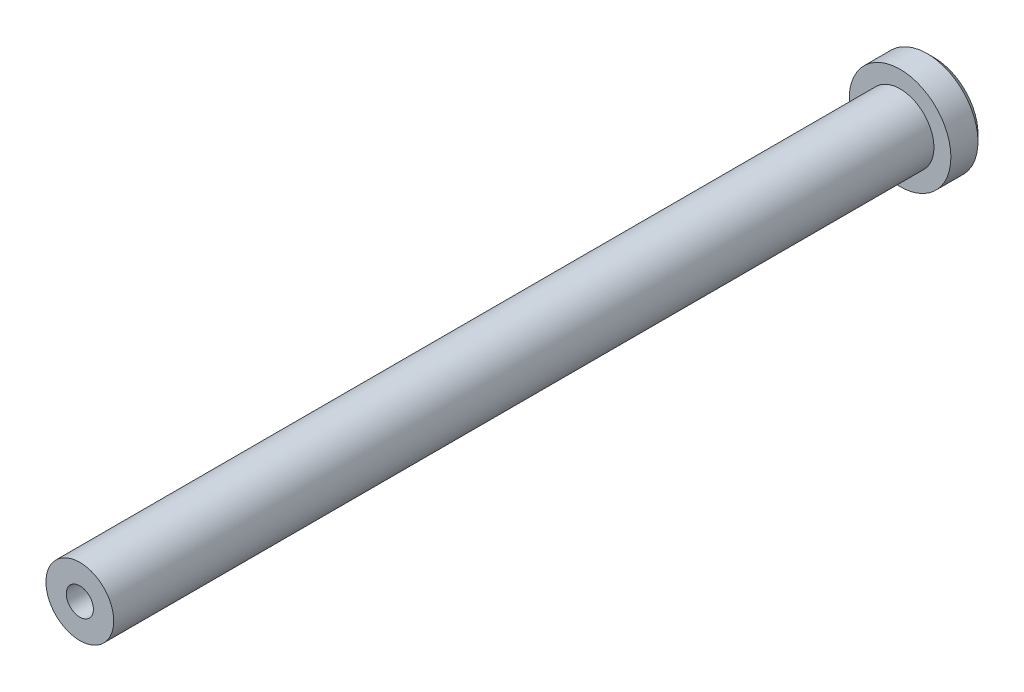
from build123d import *

# Parameters (mm, degrees)
SKETCH2_R           = 7.5
BOSS_EXTRUDE1_DEPTH = 5
CHAMFER1_SIZE       = 1
SKETCH3_R           = 5
BOSS_EXTRUDE2_DEPTH = 121
SKETCH4_R           = 2
CUT_EXTRUDE1_DEPTH  = 10


with BuildPart() as part:
    # Sketch2 → Boss-Extrude1 (new body)
    with BuildSketch(Plane.XY):
        Circle(SKETCH2_R)
    extrude(amount=BOSS_EXTRUDE1_DEPTH)

    # Chamfer1
    chamfer1_edges = [part.edges().sort_by_distance(p)[0] for p in [
        (-7.5, 0, 0),
    ]]
    chamfer(chamfer1_edges, length=CHAMFER1_SIZE)

    # Sketch3 → Boss-Extrude2 (add)
    with BuildSketch(Plane.XY.offset(5)):
        Circle(SKETCH3_R)
    extrude(amount=BOSS_EXTRUDE2_DEPTH)

    # Sketch4 → Cut-Extrude1 (cut)
    with BuildSketch(Plane.XY.offset(126)):
        Circle(SKETCH4_R)
    extrude(amount=-CUT_EXTRUDE1_DEPTH, mode=Mode.SUBTRACT)


solid = part.part
